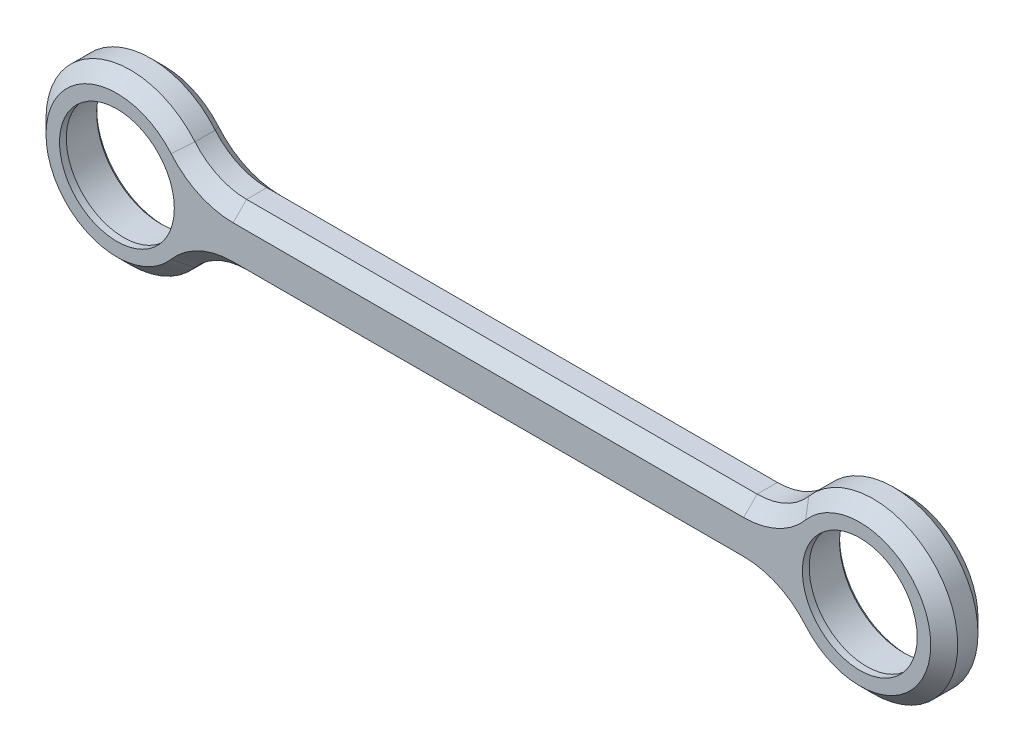
from build123d import *

# Parameters (mm, degrees)
EXTRUDE_START   = -2.5
SKETCH_2_R      = 9.5
EXTRUDE_1_DEPTH = 6
EXTRUDE_START_2 = 1
SKETCH_3_R      = 8.5
EXTRUDE_2_DEPTH = 1
FILLET_1_R      = 10
CHAMFER_1_SIZE  = 2
CHAMFER_2_SIZE  = 0.5


with BuildPart() as part:
    # 草图2 → 凸台-拉伸1 (new body)
    with BuildSketch(Plane.XY.offset(EXTRUDE_START)):
        with BuildLine():
            Line((-11.66190379, -15.5), (-98.33809621, -15.5))
            ThreePointArc((-98.33809621, -15.5), (-122.5, -20), (-98.33809621, -24.5))
            Line((-98.33809621, -24.5), (-11.66190379, -24.5))
            ThreePointArc((-11.66190379, -24.5), (12.5, -20), (-11.66190379, -15.5))
        make_face()
        with Locations(Location((0, -20, 0), (0, 0, 270))):
            Circle(SKETCH_2_R, mode=Mode.SUBTRACT)
        with Locations(Location((-110, -20, 0), (0, 0, 270))):
            Circle(SKETCH_2_R, mode=Mode.SUBTRACT)
    extrude(amount=-EXTRUDE_1_DEPTH)

    # 草图3 → 凸台-拉伸2 (add)
    with BuildSketch(Plane.XY.offset(-2.5).offset(EXTRUDE_START_2)):
        with BuildLine():
            Line((-98.33809621, -24.5), (-11.66190379, -24.5))
            ThreePointArc((-11.66190379, -24.5), (12.5, -20), (-11.66190379, -15.5))
            Line((-11.66190379, -15.5), (-98.33809621, -15.5))
            ThreePointArc((-98.33809621, -15.5), (-122.5, -20), (-98.33809621, -24.5))
        make_face()
        with Locations((-110, -20)):
            Circle(SKETCH_3_R, mode=Mode.SUBTRACT)
        with Locations((0, -20)):
            Circle(SKETCH_3_R, mode=Mode.SUBTRACT)
    extrude(amount=-EXTRUDE_2_DEPTH)

    # 圆角1
    fillet_1_edges = [part.edges().sort_by_distance(p)[0] for p in [
        (-11.66190379, -24.5, -5),
        (-98.33809621, -24.5, -5),
        (-98.33809621, -15.5, -5),
        (-11.66190379, -15.5, -5),
    ]]
    fillet(fillet_1_edges, radius=FILLET_1_R)

    # 倒角1
    chamfer_1_edges = [part.edges().sort_by_distance(p)[0] for p in [
        (12.5, -20, -8.5),
        (12.5, -20, -1.5),
        (-55, -15.5, -8.5),
        (-55, -15.5, -1.5),
        (-55, -24.5, -8.5),
        (-55, -24.5, -1.5),
        (-122.5, -20, -8.5),
        (-122.5, -20, -1.5),
        (-12.988280321, -14.567647006, -1.5),
        (-12.988280321, -14.567647006, -8.5),
        (-12.988280321, -25.432352994, -1.5),
        (-12.988280321, -25.432352994, -8.5),
        (-97.011719679, -25.432352994, -1.5),
        (-97.011719679, -25.432352994, -8.5),
        (-97.011719679, -14.567647006, -1.5),
        (-97.011719679, -14.567647006, -8.5),
    ]]
    chamfer(chamfer_1_edges, length=CHAMFER_1_SIZE)

    # 倒角2
    chamfer_2_edges = [part.edges().sort_by_distance(p)[0] for p in [
        (-110, -10.5, -8.5),
        (0, -10.5, -8.5),
    ]]
    chamfer(chamfer_2_edges, length=CHAMFER_2_SIZE)


solid = part.part
